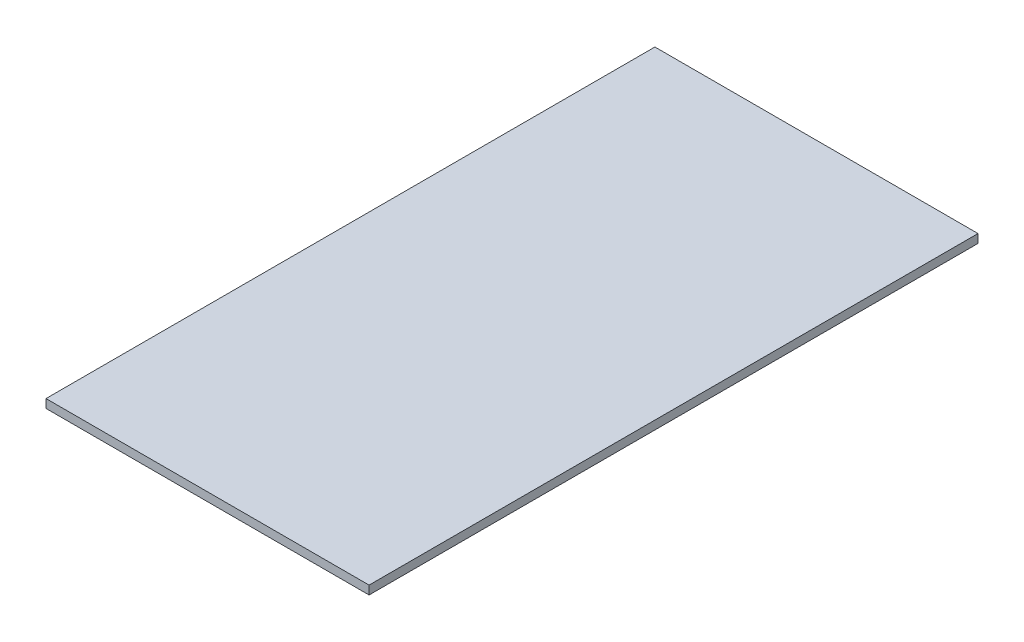
from build123d import *

# Parameters (mm, degrees)
SKETCH1_W           = 225.5
SKETCH1_H           = 425
BOSS_EXTRUDE1_DEPTH = 6


with BuildPart() as part:
    # Sketch1 → Boss-Extrude1 (new body)
    with BuildSketch(Plane(origin=(0, 0, 0), x_dir=(1, 0, 0), z_dir=(0, 1, 0))):
        Rectangle(SKETCH1_W, SKETCH1_H)
    extrude(amount=BOSS_EXTRUDE1_DEPTH)


solid = part.part
